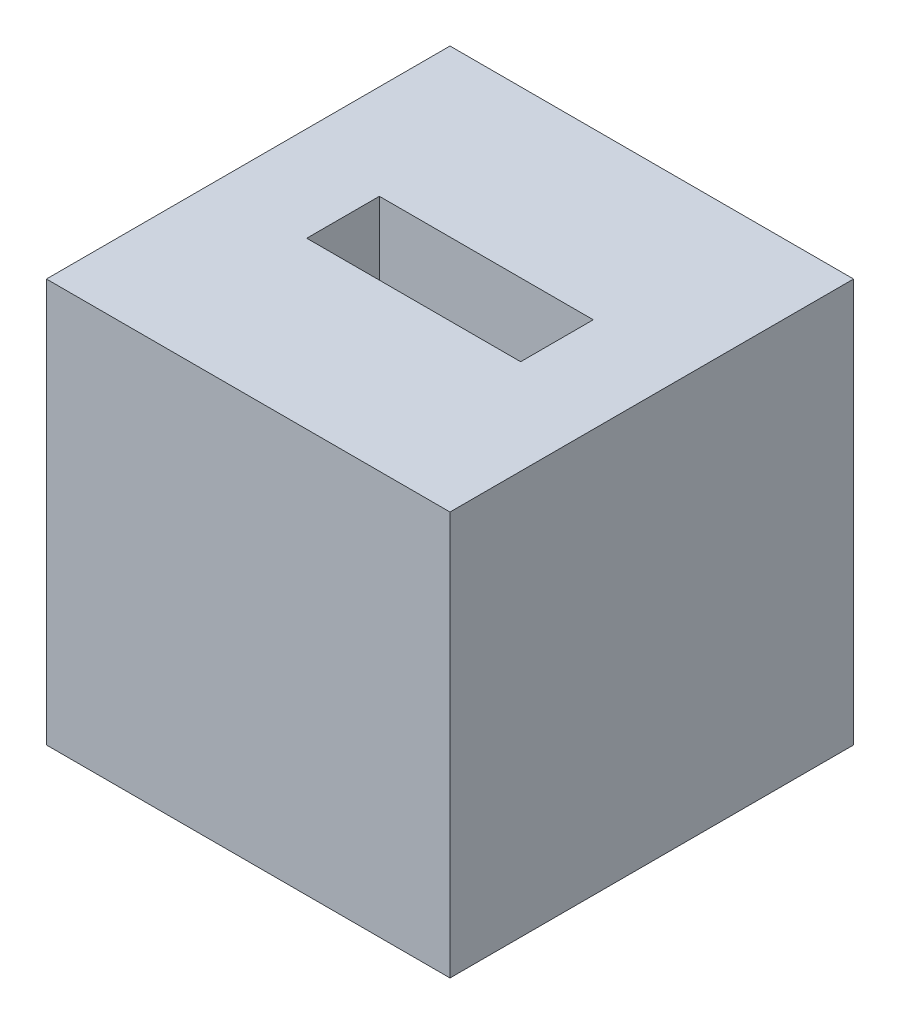
from build123d import *

# Parameters (mm, degrees)
SKETCH_1_W          = 10
SKETCH_1_H          = 10
EXTRUDE_1_DEPTH     = 10
SKETCH_2_W          = 5.3
SKETCH_2_H          = 1.8
CUT_EXTRUDE_1_DEPTH = 13.247448714


with BuildPart() as part:
    # 草图1 → 凸台-拉伸1 (new body)
    with BuildSketch(Plane(origin=(0, 0, 0), x_dir=(1, 0, 0), z_dir=(0, 1, 0))):
        Rectangle(SKETCH_1_W, SKETCH_1_H)
    extrude(amount=EXTRUDE_1_DEPTH)

    # 草图2 → 切除-拉伸1 (cut, through all)
    with BuildSketch(Plane(origin=(0, 10, 0), x_dir=(1, 0, 0), z_dir=(0, 1, 0))):
        Rectangle(SKETCH_2_W, SKETCH_2_H)
    extrude(amount=-CUT_EXTRUDE_1_DEPTH, mode=Mode.SUBTRACT)


solid = part.part
